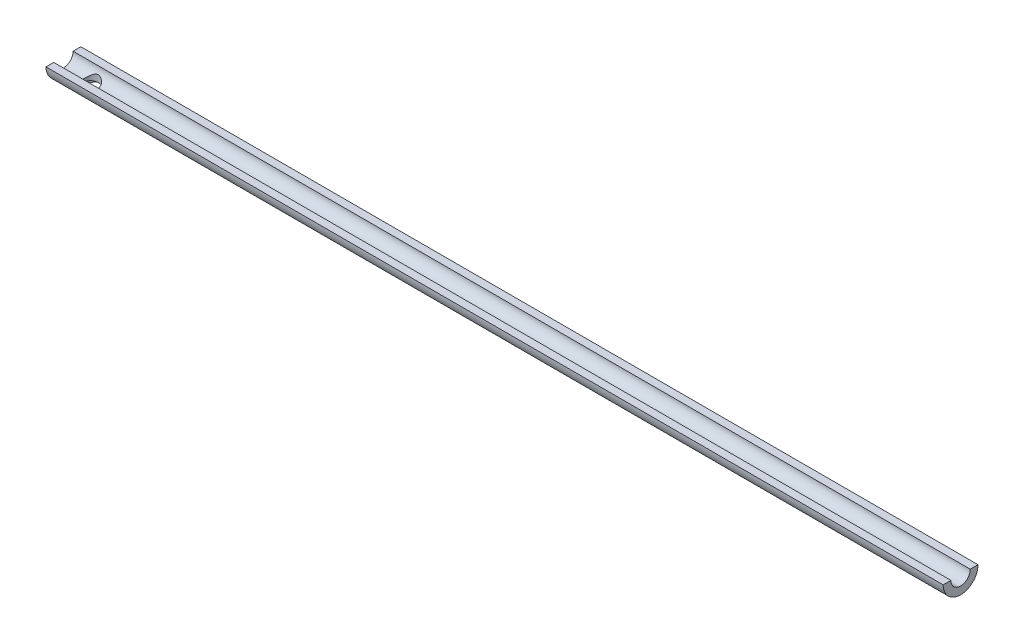
from build123d import *

# Parameters (mm, degrees)
SKETCH1_W                     = 735.584
SKETCH1_H                     = 38.1
WOOD_BLOCK_DEPTH              = 15.875
SKETCH2_R                     = 7.9375
INNER_BORE_DEPTH              = 737.741098814
SKETCH3_R                     = 6.35
MOUTHPIECE_THROUGH_HOLE_DEPTH = 737.741098814
SKETCH5_R                     = 8.128
CUT_EXTRUDE3_DEPTH            = 5.5499
SKETCH4_OUTSIDE_W             = 187.448
SKETCH4_OUTSIDE_H             = 165.223
SKETCH4_OUTSIDE_R             = 14.2875
OUTER_DIAMETER_DEPTH          = 737.741098916


with BuildPart() as part:
    # Sketch1 → wood block (new body)
    with BuildSketch(Plane(origin=(0, 0, 0), x_dir=(1, 0, 0), z_dir=(0, 1, 0))):
        with Locations((367.792, 19.05)):
            Rectangle(SKETCH1_W, SKETCH1_H)
    extrude(amount=WOOD_BLOCK_DEPTH)

    # Sketch2 → inner bore (cut, through all)
    with BuildSketch(Plane(origin=(735.584, 0, 0), x_dir=(0, 0, -1), z_dir=(1, 0, 0))):
        with Locations((19.05, 15.875)):
            Circle(SKETCH2_R)
    extrude(amount=-INNER_BORE_DEPTH, mode=Mode.SUBTRACT)

    # Sketch3 → mouthpiece through hole (cut, through all)
    with BuildSketch(Plane(origin=(0, 0, 0), x_dir=(1, 0, 0), z_dir=(0, 1, 0))):
        with Locations(Location((22.225, 19.05, 0), (0, 0, 90))):
            Circle(SKETCH3_R)
    extrude(amount=MOUTHPIECE_THROUGH_HOLE_DEPTH, mode=Mode.SUBTRACT)

    # Sketch5 → Cut-Extrude3 (cut)
    with BuildSketch(Plane.XZ):
        with Locations(Location((22.225, -19.05, 0), (0, 0, 270))):
            Circle(SKETCH5_R)
    extrude(amount=-CUT_EXTRUDE3_DEPTH, mode=Mode.SUBTRACT)

    # Sketch4 outside → outer diameter (cut, through all)
    with BuildSketch(Plane.ZY):
        with Locations((-19.05, 7.9375)):
            Rectangle(SKETCH4_OUTSIDE_W, SKETCH4_OUTSIDE_H)
        with Locations((-19.05, 15.875)):
            Circle(SKETCH4_OUTSIDE_R, mode=Mode.SUBTRACT)
    extrude(amount=-OUTER_DIAMETER_DEPTH, mode=Mode.SUBTRACT)


solid = part.part
